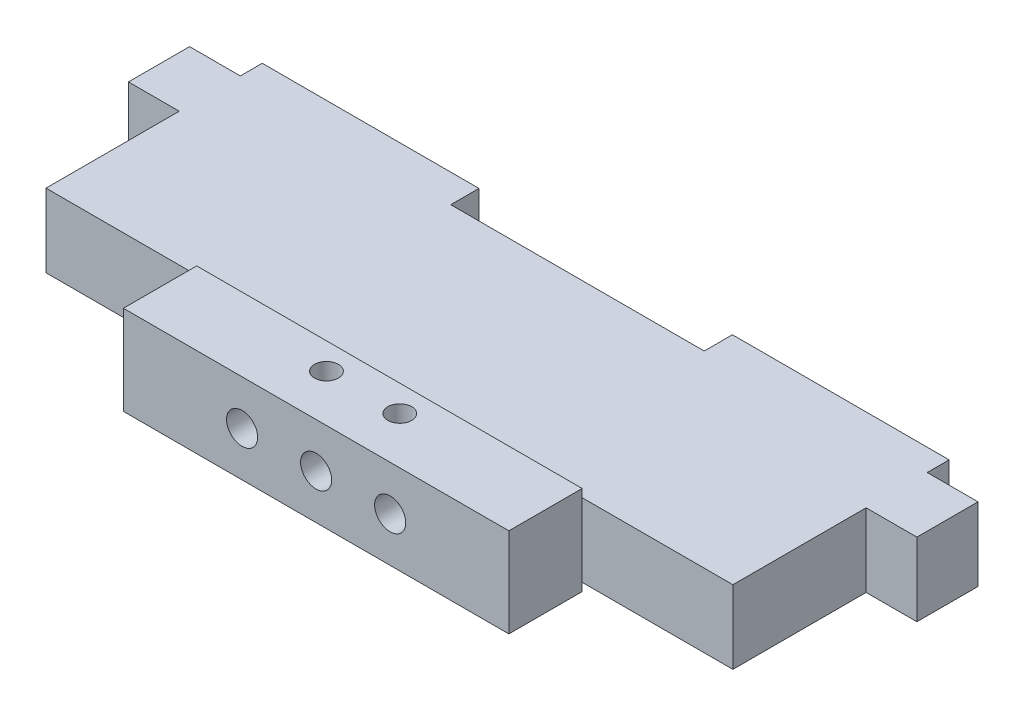
from build123d import *

# Parameters (mm, degrees)
BOSS_EXTRUDE1_DEPTH                 = 4.953
SKETCH4_W                           = 52.07
SKETCH4_H                           = 9.906
BOSS_EXTRUDE3_DEPTH                 = 6.0325
SKETCH5_R                           = 1.6129
CUT_EXTRUDE1_DEPTH                  = 12.065
M5X0_8_TAPPED_HOLE1_D               = 4.2
M5X0_8_TAPPED_HOLE1_DEPTH           = 7.62
M5X0_8_TAPPED_HOLE1_TIP             = 1.2618073
M5X0_8_TAPPED_HOLE1_ON_FACE_2_D     = 4.2
M5X0_8_TAPPED_HOLE1_ON_FACE_2_DEPTH = 7.62
M5X0_8_TAPPED_HOLE1_ON_FACE_2_TIP   = 1.2618073


with BuildPart() as part:
    # Sketch1 → Boss-Extrude1 (new, symmetric)
    with BuildSketch(Plane(origin=(0, 0, 0), x_dir=(1, 0, 0), z_dir=(0, 1, 0))):
        Polygon((17.1196, 3.81), (46.3931, 3.81), (46.3931, 0.8509), (53.2511, 0.8509), (53.2511, -7.4041), (46.3931, -7.4041), (46.3931, -25.4), (26.035, -25.4), (-26.035, -25.4), (-46.3931, -25.4), (-46.3931, -7.4041), (-53.2511, -7.4041), (-53.2511, 0.8509), (-46.3931, 0.8509), (-46.3931, 3.81), (-17.1196, 3.81), (-17.1196, 0), (17.1196, 0), align=None)
    extrude(amount=BOSS_EXTRUDE1_DEPTH, both=True)

    # Sketch4 → Boss-Extrude3 (add, symmetric)
    with BuildSketch(Plane(origin=(0, 0, 0), x_dir=(1, 0, 0), z_dir=(0, 1, 0))):
        with Locations((0, -30.353)):
            Rectangle(SKETCH4_W, SKETCH4_H)
    extrude(amount=BOSS_EXTRUDE3_DEPTH, both=True)

    # Sketch5 → Cut-Extrude1 (cut)
    with BuildSketch(Plane(origin=(0, 6.0325, 0), x_dir=(1, 0, 0), z_dir=(0, 1, 0))):
        with Locations(Location((-4.953, -28.956, 0), (0, 0, 270))):
            Circle(SKETCH5_R)
        with Locations(Location((4.953, -28.956, 0), (0, 0, 270))):
            Circle(SKETCH5_R)
    extrude(amount=-CUT_EXTRUDE1_DEPTH, mode=Mode.SUBTRACT)

    # M5x0.8 Tapped Hole1
    with Locations(Plane.XY.offset(35.306)):
        with Locations((0, 0), (-10, 0), (10, 0)):
            Hole(M5X0_8_TAPPED_HOLE1_D / 2, depth=M5X0_8_TAPPED_HOLE1_DEPTH)
            with Locations((0, 0, -(M5X0_8_TAPPED_HOLE1_DEPTH + M5X0_8_TAPPED_HOLE1_TIP / 2))):  # 118° drill point
                Cone(0, M5X0_8_TAPPED_HOLE1_D / 2, M5X0_8_TAPPED_HOLE1_TIP, mode=Mode.SUBTRACT)

    # M5x0.8 Tapped Hole1 on face 2
    with Locations(Plane(origin=(-5, 0, 0), x_dir=(-1, 0, 0), z_dir=(0, 0, -1))):
        with Locations((0, 0), (-10, 0)):
            Hole(M5X0_8_TAPPED_HOLE1_ON_FACE_2_D / 2, depth=M5X0_8_TAPPED_HOLE1_ON_FACE_2_DEPTH)
            with Locations((0, 0, -(M5X0_8_TAPPED_HOLE1_ON_FACE_2_DEPTH + M5X0_8_TAPPED_HOLE1_ON_FACE_2_TIP / 2))):  # 118° drill point
                Cone(0, M5X0_8_TAPPED_HOLE1_ON_FACE_2_D / 2, M5X0_8_TAPPED_HOLE1_ON_FACE_2_TIP, mode=Mode.SUBTRACT)


solid = part.part
